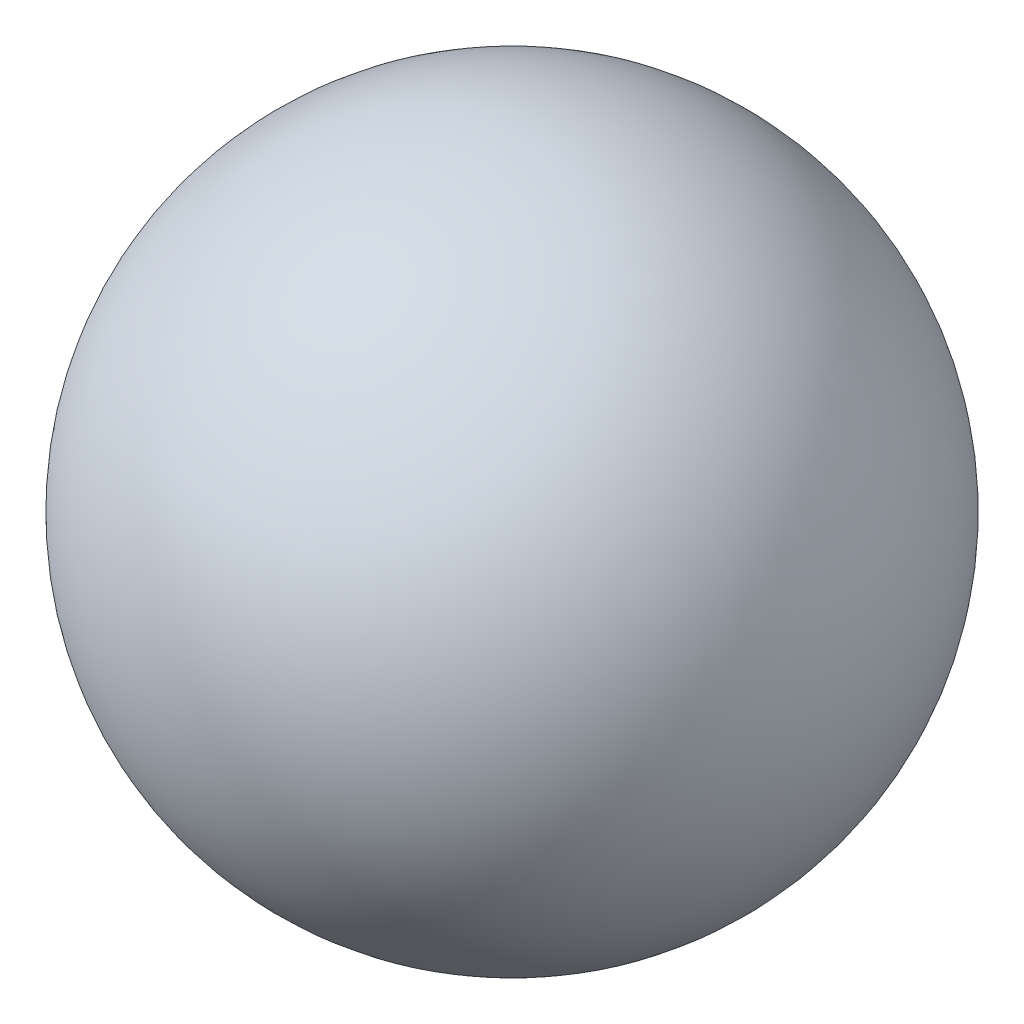
from build123d import *


with BuildPart() as part:
    # 草图1 → 旋转1 (revolve)
    with BuildSketch(Plane.XY):
        with BuildLine():
            Line((0, 9), (0, -9))
            ThreePointArc((0, -9), (9, 0), (0, 9))
        make_face()
    revolve(axis=Axis((0, 9, 0), (0, -1, 0)))


solid = part.part
